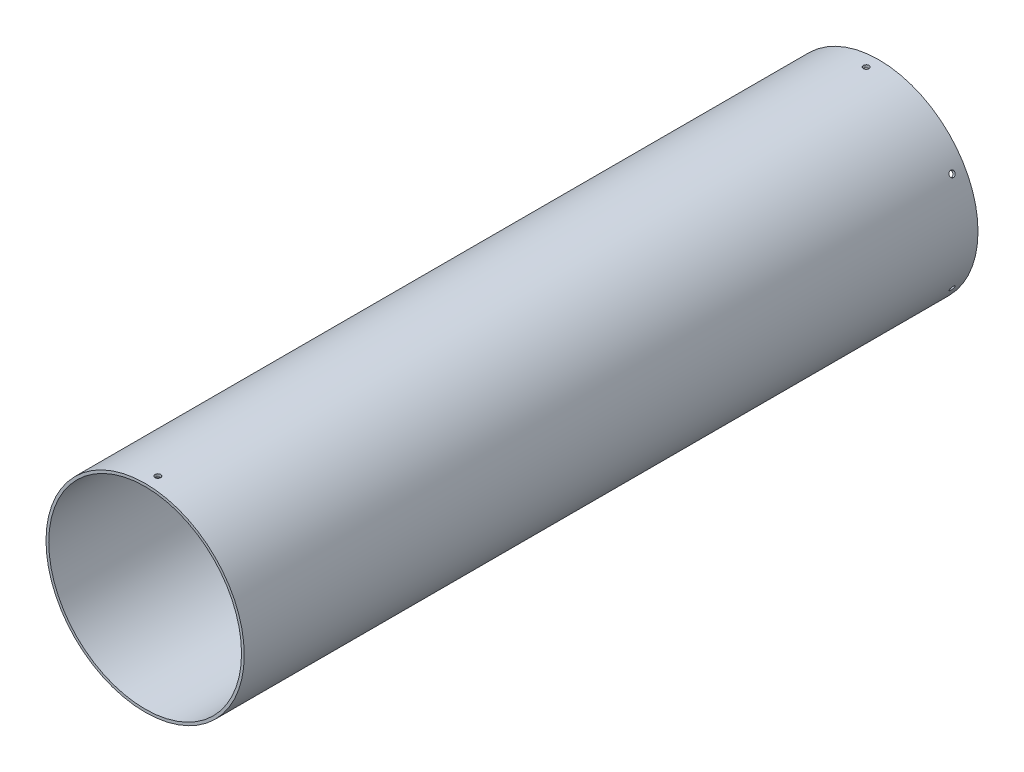
from build123d import *

# Parameters (mm, degrees)
SKETCH1_R           = 78.359
SKETCH1_R_2         = 76.2
BOSS_EXTRUDE1_DEPTH = 580
SKETCH5_W           = 2.25
SKETCH5_H           = 78.359
CIRPATTERN1_COUNT   = 6
SKETCH7_W           = 2.25
SKETCH7_H           = 78.359


with BuildPart() as part:
    # Sketch1 → Boss-Extrude1 (new body)
    with BuildSketch(Plane.XY):
        Circle(SKETCH1_R)
        Circle(SKETCH1_R_2, mode=Mode.SUBTRACT)
    extrude(amount=BOSS_EXTRUDE1_DEPTH)

    # Sketch5 → M4 Clearance Hole2 (revolve, cut)
    with BuildSketch(Plane(origin=(0, 0, 10), x_dir=(0, 0, 1), z_dir=(1, 0, 0))):
        with Locations((1.125, 39.1795)):
            Rectangle(SKETCH5_W, SKETCH5_H)
    m4_clearance_hole2 = revolve(axis=Axis((0, 6.35, 10), (0, -1, 0)), mode=Mode.SUBTRACT)

    # CirPattern1: M4 Clearance Hole2 ×6 about axis
    cirpattern1_axis = Axis((0, 0, 580), (0, 0, -1))
    for i in range(1, CIRPATTERN1_COUNT):
        add(m4_clearance_hole2.rotate(cirpattern1_axis, i * 360 / CIRPATTERN1_COUNT), mode=Mode.SUBTRACT)

    # Sketch7 → M4 Clearance Hole3 (revolve, cut)
    with BuildSketch(Plane(origin=(0, 0, 570), x_dir=(0, 0, -1), z_dir=(1, 0, 0))):
        with Locations((1.125, 39.1795)):
            Rectangle(SKETCH7_W, SKETCH7_H)
    revolve(axis=Axis((0, -6.35, 570), (0, 1, 0)), mode=Mode.SUBTRACT)


solid = part.part
